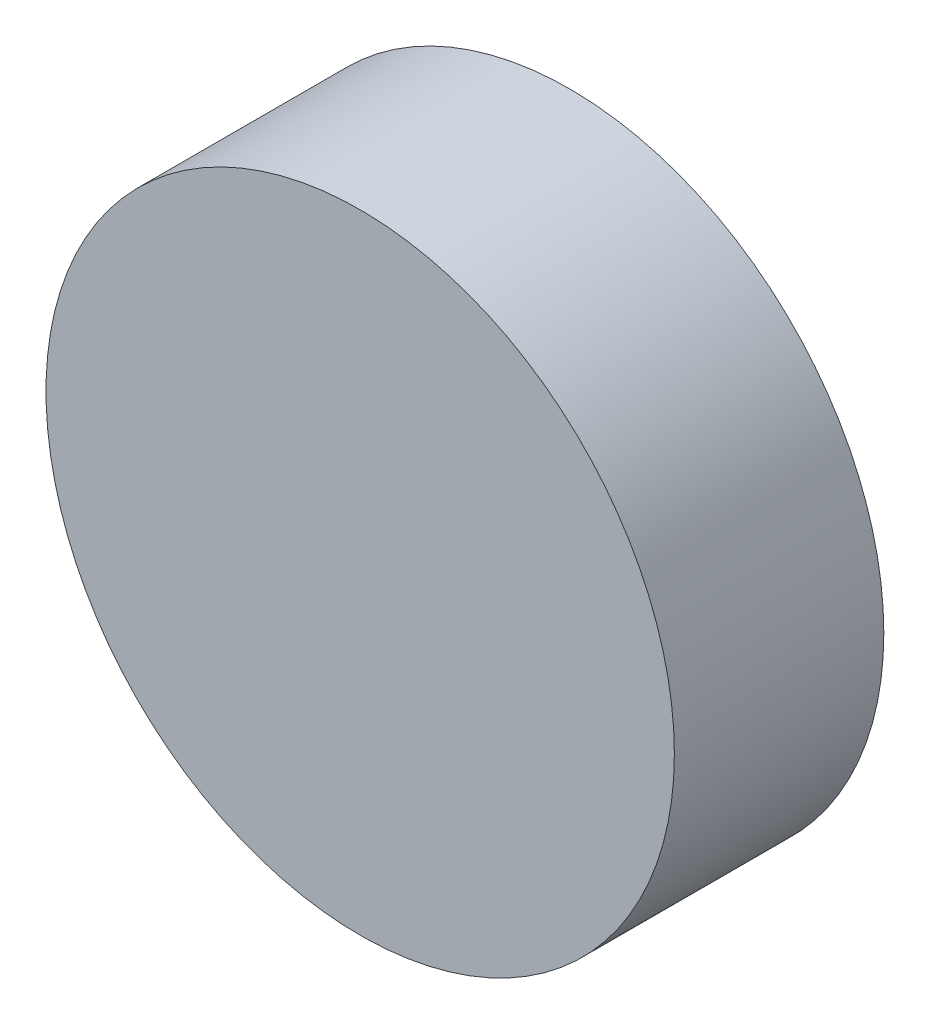
from build123d import *

# Parameters (mm, degrees)
SKETCH_1_R      = 12
EXTRUDE_1_DEPTH = 4


with BuildPart() as part:
    # 草图1 → 凸台-拉伸1 (new, symmetric)
    with BuildSketch(Plane.XY):
        Circle(SKETCH_1_R)
    extrude(amount=EXTRUDE_1_DEPTH, both=True)


solid = part.part
